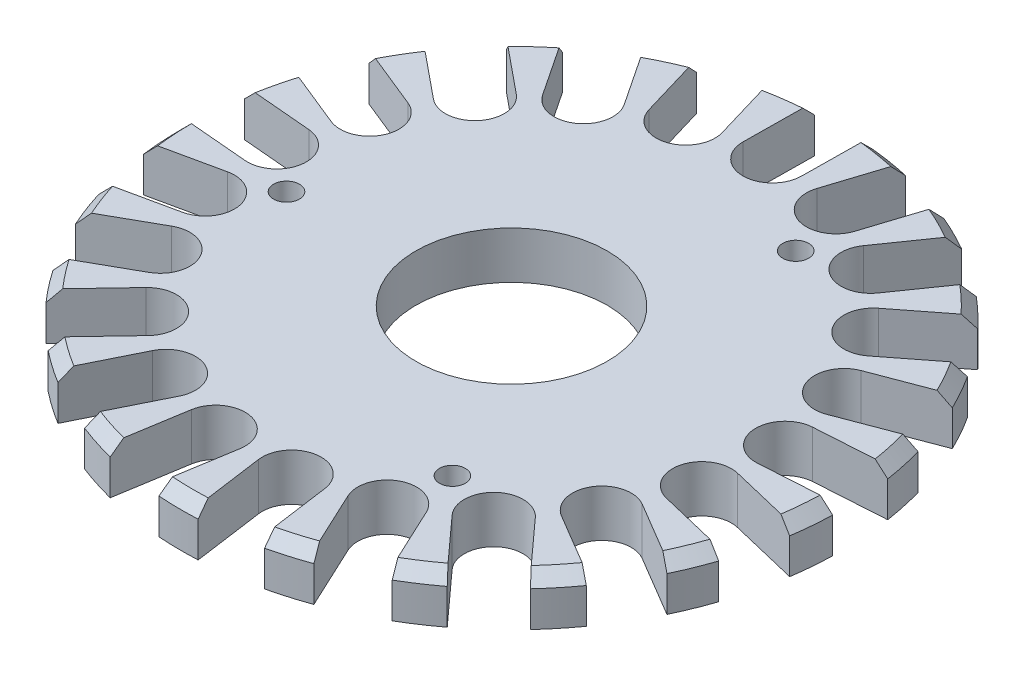
from build123d import *

# Parameters (mm, degrees)
SKETCH1_R            = 28
BOSS_EXTRUDE1_DEPTH  = 4
SKETCH3_R            = 8.125
CUT_EXTRUDE3_DEPTH   = 40.799497484
CUT_EXTRUDE4_DEPTH   = 40.799497484
M2_CLEARANCE_HOLE1_D = 2.2
CHAMFER1_SIZE        = 1


with BuildPart() as part:
    # Sketch1 → Boss-Extrude1 (new body)
    with BuildSketch(Plane(origin=(0, 0, 0), x_dir=(1, 0, 0), z_dir=(0, 1, 0))):
        Circle(SKETCH1_R)
    extrude(amount=BOSS_EXTRUDE1_DEPTH)

    # Sketch3 → Cut-Extrude3 (cut, through all)
    with BuildSketch(Plane(origin=(0, 0, 0), x_dir=(-1, 0, 0), z_dir=(0, -1, 0))):
        Circle(SKETCH3_R)
    extrude(amount=-CUT_EXTRUDE3_DEPTH, mode=Mode.SUBTRACT)

    # Sketch4 → Cut-Extrude4 (cut, through all)
    with BuildSketch(Plane(origin=(0, 4, 0), x_dir=(1, 0, 0), z_dir=(0, 1, 0))):
        with BuildLine():
            Line((6.145520364, 27.317257905), (4.3111973, 21.604530107))
            ThreePointArc((4.3111973, 21.604530107), (5.927306058, 18.459717785), (9.07211838, 20.075826543))
            Line((9.07211838, 20.075826543), (10.906441444, 25.788554342))
            ThreePointArc((10.906441444, 25.788554342), (8.560174299, 26.659396392), (6.145520364, 27.317257905))
        make_face()
        with BuildLine():
            Line((-2.179410981, 27.91505271), (-2.248384139, 21.915449164))
            ThreePointArc((-2.248384139, 21.915449164), (0.222875146, 19.386708449), (2.751615861, 21.857967734))
            Line((2.751615861, 21.857967734), (2.820589019, 27.857571279))
            ThreePointArc((2.820589019, 27.857571279), (0.321874739, 27.998149879), (-2.179410981, 27.91505271))
        make_face()
        with BuildLine():
            Line((13.924395256, 24.292204856), (10.48770994, 19.37395374))
            ThreePointArc((10.48770994, 19.37395374), (11.105069816, 15.892500187), (14.586523369, 16.509860063))
            Line((14.586523369, 16.509860063), (18.023208685, 21.428111179))
            ThreePointArc((18.023208685, 21.428111179), (16.037864806, 22.951838542), (13.924395256, 24.292204856))
        make_face()
        with BuildLine():
            Line((20.466026522, 19.108682801), (15.732343527, 15.421916562))
            ThreePointArc((15.732343527, 15.421916562), (15.296099387, 11.913164204), (18.804851745, 11.476920064))
            Line((18.804851745, 11.476920064), (23.53853474, 15.163686303))
            ThreePointArc((23.53853474, 15.163686303), (22.090520644, 17.204909116), (20.466026522, 19.108682801))
        make_face()
        with BuildLine():
            Line((25.189161519, 12.227270422), (19.579089352, 10.099574419))
            ThreePointArc((19.579089352, 10.099574419), (18.128003402, 6.875291302), (21.352286519, 5.424205351))
            Line((21.352286519, 5.424205351), (26.962358687, 7.551901354))
            ThreePointArc((26.962358687, 7.551901354), (26.18033678, 9.929248012), (25.189161519, 12.227270422))
        make_face()
        with BuildLine():
            Line((27.674128974, 4.259411407), (21.686147166, 3.879840768))
            ThreePointArc((21.686147166, 3.879840768), (19.349154761, 1.226518595), (22.002476934, -1.11047381))
            Line((22.002476934, -1.11047381), (27.990458741, -0.730903171))
            ThreePointArc((27.990458741, -0.730903171), (27.943915103, 1.771329648), (27.674128974, 4.259411407))
        make_face()
        with BuildLine():
            Line((27.700128623, -4.086915003), (21.866295637, -2.684633761))
            ThreePointArc((21.866295637, -2.684633761), (18.851048807, -4.531235671), (20.697650716, -7.546482501))
            Line((20.697650716, -7.546482501), (26.531483703, -8.948763742))
            ThreePointArc((26.531483703, -8.948763742), (27.224553939, -6.543979128), (27.700128623, -4.086915003))
        make_face()
        with BuildLine():
            Line((25.264850285, -12.07010108), (20.103527781, -9.0105668))
            ThreePointArc((20.103527781, -9.0105668), (16.67794444, -9.886369762), (17.553747402, -13.311953104))
            Line((17.553747402, -13.311953104), (22.715069906, -16.371487384))
            ThreePointArc((22.715069906, -16.371487384), (24.086171685, -14.277826641), (25.264850285, -12.07010108))
        make_face()
        with BuildLine():
            Line((20.584679125, -18.980805707), (16.554473259, -14.535871436))
            ThreePointArc((16.554473259, -14.535871436), (13.022931519, -14.363056515), (12.850116598, -17.894598255))
            Line((12.850116598, -17.894598255), (16.880322465, -22.339532526))
            ThreePointArc((16.880322465, -22.339532526), (18.807627376, -20.743026599), (20.584679125, -18.980805707))
        make_face()
        with BuildLine():
            Line((14.075468891, -24.204982452), (11.53448114, -18.769600106))
            ThreePointArc((11.53448114, -18.769600106), (8.210773983, -17.563522665), (7.004696543, -20.887229822))
            Line((7.004696543, -20.887229822), (9.545684294, -26.322612168))
            ThreePointArc((9.545684294, -26.322612168), (11.857942838, -25.365117615), (14.075468891, -24.204982452))
        make_face()
        with BuildLine():
            Line((6.315591477, -27.278440283), (5.489599754, -21.335567437))
            ThreePointArc((5.489599754, -21.335567437), (2.669053147, -19.20339275), (0.53687846, -22.023939357))
            Line((0.53687846, -22.023939357), (1.362870183, -27.966812204))
            ThreePointArc((1.362870183, -27.966812204), (3.854628042, -27.733406618), (6.315591477, -27.278440283))
        make_face()
        with BuildLine():
            Line((-2.005453955, -27.928088986), (-1.043056662, -22.005775971))
            ThreePointArc((-1.043056662, -22.005775971), (-3.109824775, -19.136957117), (-5.97864363, -21.20372523))
            Line((-5.97864363, -21.20372523), (-6.941040924, -27.126038245))
            ThreePointArc((-6.941040924, -27.126038245), (-4.491187371, -27.637460737), (-2.005453955, -27.928088986))
        make_face()
        with BuildLine():
            Line((-10.148306003, -26.096204423), (-7.483032915, -20.72067474))
            ThreePointArc((-7.483032915, -20.72067474), (-8.612381119, -17.370118862), (-11.962936997, -18.499467066))
            Line((-11.962936997, -18.499467066), (-14.628210085, -23.874996748))
            ThreePointArc((-14.628210085, -23.874996748), (-12.437941078, -25.085805184), (-10.148306003, -26.096204423))
        make_face()
        with BuildLine():
            Line((-17.389436527, -21.945557575), (-13.258108855, -17.594450627))
            ThreePointArc((-13.258108855, -17.594450627), (-13.349689605, -14.059869319), (-16.884270913, -14.151450068))
            Line((-16.884270913, -14.151450068), (-21.015598585, -18.502557016))
            ThreePointArc((-21.015598585, -18.502557016), (-19.279529136, -20.305165754), (-17.389436527, -21.945557575))
        make_face()
        with BuildLine():
            Line((-23.085439304, -15.844951629), (-17.855143642, -12.904882364))
            ThreePointArc((-17.855143642, -12.904882364), (-16.900819585, -9.500338686), (-20.305363263, -8.54601463))
            Line((-20.305363263, -8.54601463), (-25.535658925, -11.486083895))
            ThreePointArc((-25.535658925, -11.486083895), (-24.408046424, -13.720323238), (-23.085439304, -15.844951629))
        make_face()
        with BuildLine():
            Line((-26.73019949, -8.336452198), (-20.865670559, -7.068658671))
            ThreePointArc((-20.865670559, -7.068658671), (-18.950237578, -4.09666127), (-21.922234979, -2.181228288))
            Line((-21.922234979, -2.181228288), (-27.786763909, -3.449021815))
            ThreePointArc((-27.786763909, -3.449021815), (-27.367801674, -5.916369792), (-26.73019949, -8.336452198))
        make_face()
        with BuildLine():
            Line((-27.999864147, -0.087222404), (-22.02219108, -0.604353634))
            ThreePointArc((-22.02219108, -0.604353634), (-19.3158438, 1.671022478), (-21.591219912, 4.377369759))
            Line((-21.591219912, 4.377369759), (-27.568892979, 4.894500989))
            ThreePointArc((-27.568892979, 4.894500989), (-27.895807644, 2.413279073), (-27.999864147, -0.087222404))
        make_face()
        with BuildLine():
            Line((-26.781618, 8.169757483), (-21.221943281, 5.913650875))
            ThreePointArc((-21.221943281, 5.913650875), (-17.965152534, 7.290228546), (-19.341730205, 10.547019294))
            Line((-19.341730205, 10.547019294), (-24.901404923, 12.803125901))
            ThreePointArc((-24.901404923, 12.803125901), (-25.945148686, 10.528497503), (-26.781618, 8.169757483))
        make_face()
        with BuildLine():
            Line((-23.183707564, 15.700818565), (-18.53603269, 11.906201552))
            ThreePointArc((-18.53603269, 11.906201552), (-15.018178626, 12.261665815), (-15.373642889, 15.779519879))
            Line((-15.373642889, 15.779519879), (-20.021317763, 19.574136892))
            ThreePointArc((-20.021317763, 19.574136892), (-21.689149409, 17.708212725), (-23.183707564, 15.700818565))
        make_face()
        with BuildLine():
            Line((-17.525822971, 21.836793015), (-14.203114251, 16.840833972))
            ThreePointArc((-14.203114251, 16.840833972), (-10.736773642, 16.143600267), (-10.039539937, 19.609940876))
            Line((-10.039539937, 19.609940876), (-13.362248657, 24.605899919))
            ThreePointArc((-13.362248657, 24.605899919), (-15.505974025, 23.314475536), (-17.525822971, 21.836793015))
        make_face()
        with BuildLine():
            Line((-10.310692096, 26.032472578), (-8.608186781, 20.279084389))
            ThreePointArc((-8.608186781, 20.279084389), (-5.501359202, 18.59110499), (-3.813379803, 21.697932569))
            Line((-3.813379803, 21.697932569), (-5.515885118, 27.451320758))
            ThreePointArc((-5.515885118, 27.451320758), (-7.945024803, 26.849144882), (-10.310692096, 26.032472578))
        make_face()
    extrude(amount=-CUT_EXTRUDE4_DEPTH, mode=Mode.SUBTRACT)

    # M2 Clearance Hole1 (through all)
    with Locations(Plane(origin=(0, 0, 0), x_dir=(-1, 0, 0), z_dir=(0, -1, 0))):
        with Locations((-7.995819264, 16.126589047), (17.963945423, -1.138711917), (-9.968126159, -14.98787713)):
            Hole(M2_CLEARANCE_HOLE1_D / 2)

    # Chamfer1
    chamfer1_edges = [part.edges().sort_by_distance(p)[0] for p in [
        (-18.807627376, 4, -20.743026599),
        (-11.857942838, 4, -25.365117615),
        (-3.854628042, 4, -27.733406618),
        (4.491187371, 4, -27.637460737),
        (12.437941078, 4, -25.085805184),
        (19.279529136, 4, -20.305165754),
        (24.408046424, 4, -13.720323238),
        (27.367801674, 4, -5.916369792),
        (27.895807644, 4, 2.413279073),
        (25.945148686, 4, 10.528497503),
        (21.689149409, 4, 17.708212725),
        (15.505974025, 4, 23.314475536),
        (7.945024803, 4, 26.849144882),
        (-0.321874739, 4, 27.998149879),
        (-8.560174299, 4, 26.659396392),
        (-16.037864806, 4, 22.951838542),
        (-22.090520644, 4, 17.204909116),
        (-26.18033678, 4, 9.929248012),
        (-27.943915103, 4, 1.771329648),
        (-27.224553939, 4, -6.543979128),
        (-24.086171685, 4, -14.277826641),
    ]]
    chamfer(chamfer1_edges, length=CHAMFER1_SIZE)


solid = part.part
